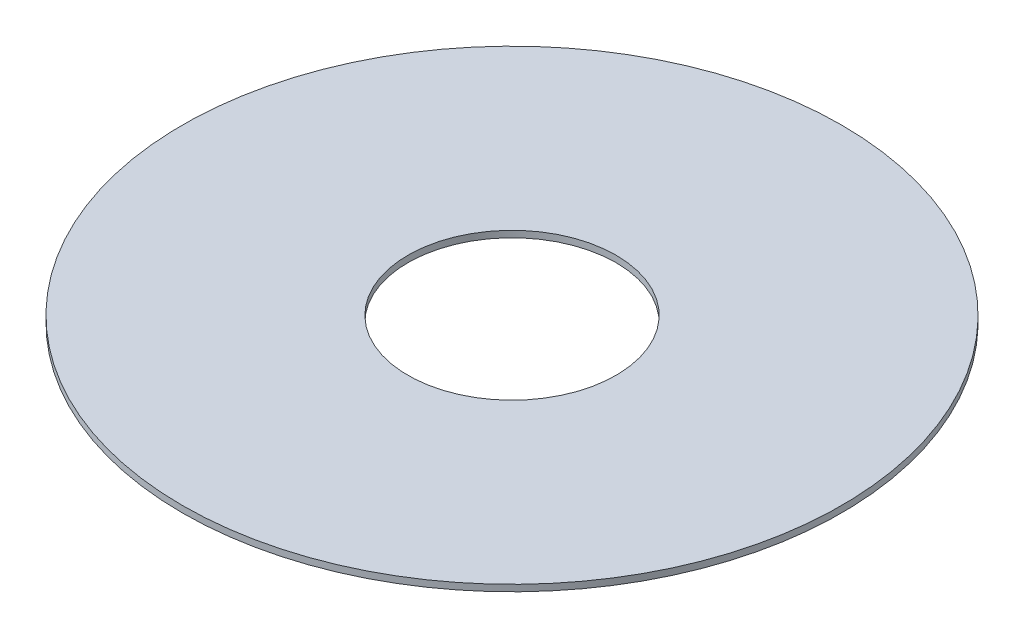
from build123d import *

# Parameters (mm, degrees)
SKETCH1_R           = 241.3
SKETCH1_R_2         = 76.2
BOSS_EXTRUDE1_DEPTH = 4.7625


with BuildPart() as part:
    # Sketch1 → Boss-Extrude1 (new body)
    with BuildSketch(Plane(origin=(0, 0, 0), x_dir=(1, 0, 0), z_dir=(0, 1, 0))):
        with Locations(Location((0, 0, 0), (0, 0, 90))):
            Circle(SKETCH1_R)
        with Locations(Location((0, 0, 0), (0, 0, 90))):
            Circle(SKETCH1_R_2, mode=Mode.SUBTRACT)
    extrude(amount=BOSS_EXTRUDE1_DEPTH)


solid = part.part
